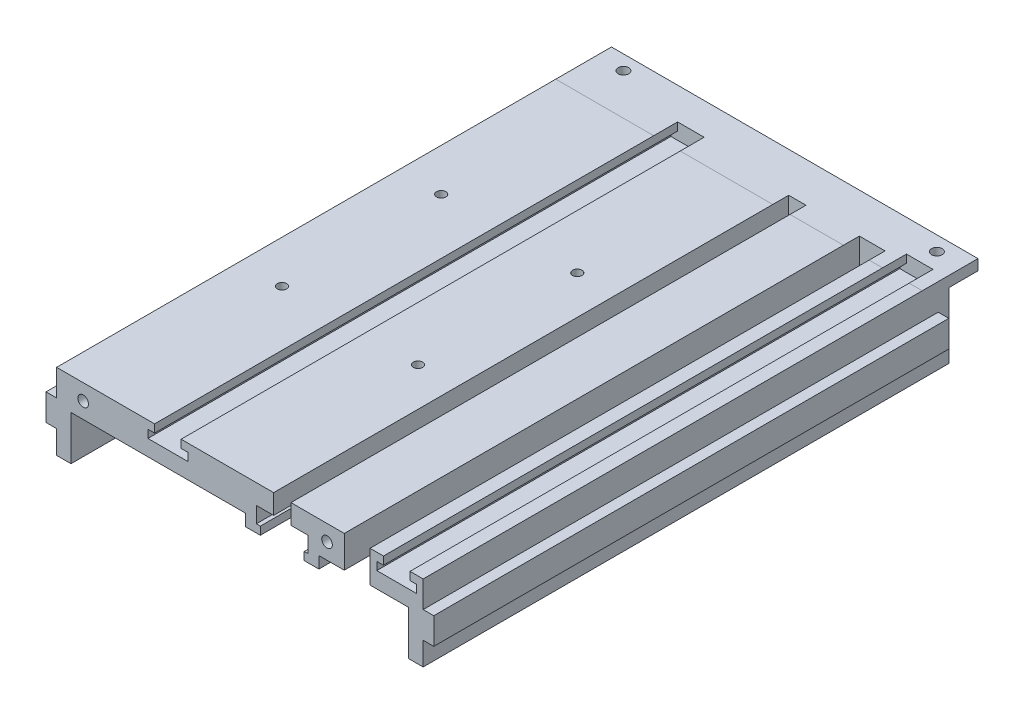
from build123d import *

# Parameters (mm, degrees)
CROQUIS1_W              = 170
CROQUIS1_H              = 50
SALIENTE_EXTRUIR1_DEPTH = 4
CROQUIS3_W              = 20
CROQUIS3_H              = 12.01
SALIENTE_EXTRUIR2_DEPTH = 194
CROQUIS22_W             = 170
CROQUIS22_H             = 21.26
CORTAR_EXTRUIR12_DEPTH  = 10
CROQUIS23_W             = 170
CROQUIS23_H             = 8.12284292
SALIENTE_EXTRUIR6_DEPTH = 11
CROQUIS25_W             = 6.514763964
CROQUIS25_H             = 194
CORTAR_EXTRUIR16_DEPTH  = 10
CROQUIS27_R             = 1.75
CORTAR_EXTRUIR17_DEPTH  = 30.74
CORTAR_EXTRUIR18_DEPTH  = 197
CROQUIS29_W             = 31.946298055
CROQUIS29_H             = 28.740140904
CORTAR_EXTRUIR19_DEPTH  = 197
CROQUIS30_R             = 2
CORTAR_EXTRUIR20_DEPTH  = 197
CROQUIS31_R             = 2
UNI_N_TECHO_DEPTH       = 10
CROQUIS33_R             = 2
CORTAR_EXTRUIR22_DEPTH  = 10
CROQUIS35_W             = 138.053701945
CROQUIS35_H             = 11
CORTAR_EXTRUIR24_DEPTH  = 4.12
SALIENTE_EXTRUIR7_DEPTH = 194


with BuildPart() as part:
    # Croquis1 → Saliente-Extruir1 (new body)
    with BuildSketch(Plane.XY):
        Rectangle(CROQUIS1_W, CROQUIS1_H)
    extrude(amount=SALIENTE_EXTRUIR1_DEPTH)

    # Croquis3 → Saliente-Extruir2 (add)
    with BuildSketch(Plane.XY.offset(4)):
        Polygon((-13.772145946, -12.69105844), (-9.772145946, -12.69105844), (-8.272145946, -12.69105844), (-8.272145946, -9.69105844), (-9.772145946, -9.69105844), (-9.772145946, -3.69105844), (9.772145946, -3.69105844), (9.772145946, -9.69105844), (8.272145946, -9.69105844), (8.272145946, -12.69105844), (9.772145946, -12.69105844), (13.772145946, -12.69105844), (13.772145946, -8.269859096), (23.357191672, -8.269859096), (23.357191672, 3.740140904), (-85, 3.740140904), (-85, -8.269859096), (-13.772145946, -8.269859096), align=None)
        with Locations((43.053701945, -2.264859096)):
            Rectangle(CROQUIS3_W, CROQUIS3_H)
    extrude(amount=SALIENTE_EXTRUIR2_DEPTH)

    # Croquis22 → Cortar-Extruir12 (cut)
    with BuildSketch(Plane(origin=(0, 0, 0), x_dir=(-1, 0, 0), z_dir=(0, 0, -1))):
        with Locations((0, 14.37)):
            Rectangle(CROQUIS22_W, CROQUIS22_H)
    extrude(amount=-CORTAR_EXTRUIR12_DEPTH, mode=Mode.SUBTRACT)

    # Croquis23 → Saliente-Extruir6 (add)
    with BuildSketch(Plane(origin=(0, 0, 0), x_dir=(-1, 0, 0), z_dir=(0, 0, -1))):
        with Locations((0, -0.32142146)):
            Rectangle(CROQUIS23_W, CROQUIS23_H)
    extrude(amount=SALIENTE_EXTRUIR6_DEPTH)

    # Croquis25 → Cortar-Extruir16 (cut)
    with BuildSketch(Plane.XZ.offset(3.69105844)):
        with Locations((0, 101)):
            Rectangle(CROQUIS25_W, CROQUIS25_H)
    extrude(amount=-CORTAR_EXTRUIR16_DEPTH, mode=Mode.SUBTRACT)

    # Croquis27 → Cortar-Extruir17 (cut)
    with BuildSketch(Plane.XZ.offset(8.269859096)):
        with Locations(Location((-69.012145946, 129.117553519, 0), (0, 0, 270))):
            Circle(CROQUIS27_R)
        with Locations(Location((-17.772145946, 129.117553519, 0), (0, 0, 270))):
            Circle(CROQUIS27_R)
        with Locations(Location((-69.012145946, 69.117553519, 0), (0, 0, 270))):
            Circle(CROQUIS27_R)
        with Locations(Location((-17.772145946, 69.117553519, 0), (0, 0, 270))):
            Circle(CROQUIS27_R)
    extrude(amount=-CORTAR_EXTRUIR17_DEPTH, mode=Mode.SUBTRACT)

    # Croquis28 → Cortar-Extruir18 (cut)
    with BuildSketch(Plane.XY.offset(198)):
        Polygon((50.605, 0.740140904), (50.605, -2.259859096), (35.605, -2.259859096), (35.605, 0.740140904), (38.105, 0.740140904), (38.105, 3.740140904), (48.105, 3.740140904), (48.105, 0.740140904), align=None)
        Polygon((-38.105, 3.740140904), (-48.105, 3.740140904), (-48.105, 0.740140904), (-50.605, 0.740140904), (-50.605, -2.259859096), (-35.605, -2.259859096), (-35.605, 0.740140904), (-38.105, 0.740140904), align=None)
    extrude(amount=-CORTAR_EXTRUIR18_DEPTH, mode=Mode.SUBTRACT)

    # Croquis29 → Cortar-Extruir19 (cut)
    with BuildSketch(Plane.XY.offset(4)):
        with Locations((69.026850973, -10.629929548)):
            Rectangle(CROQUIS29_W, CROQUIS29_H)
    extrude(amount=-CORTAR_EXTRUIR19_DEPTH, mode=Mode.SUBTRACT)

    # Croquis30 → Cortar-Extruir20 (cut)
    with BuildSketch(Plane.XY.offset(4)):
        with Locations((-72, -16.634929548)):
            Circle(CROQUIS30_R)
        with Locations((40.053701945, -16.634929548)):
            Circle(CROQUIS30_R)
    extrude(amount=-CORTAR_EXTRUIR20_DEPTH, mode=Mode.SUBTRACT)

    # Croquis31 → Unión techo (cut)
    with BuildSketch(Plane.XY.offset(198)):
        with Locations((-75, -2.264859096)):
            Circle(CROQUIS31_R)
        with Locations((16.857191672, -2.264859096)):
            Circle(CROQUIS31_R)
    extrude(amount=-UNI_N_TECHO_DEPTH, mode=Mode.SUBTRACT)

    # Croquis33 → Cortar-Extruir22 (cut)
    with BuildSketch(Plane.XZ.offset(4.38284292)):
        with Locations(Location((-75, -5.5, 0), (0, 0, 270))):
            Circle(CROQUIS33_R)
        with Locations(Location((43.053701945, -5.5, 0), (0, 0, 270))):
            Circle(CROQUIS33_R)
    extrude(amount=-CORTAR_EXTRUIR22_DEPTH, mode=Mode.SUBTRACT)

    # Croquis35 → Cortar-Extruir24 (cut)
    with BuildSketch(Plane.XZ.offset(4.38284292)):
        with Locations((-15.973149027, -5.5)):
            Rectangle(CROQUIS35_W, CROQUIS35_H)
    extrude(amount=-CORTAR_EXTRUIR24_DEPTH, mode=Mode.SUBTRACT)

    # Croquis36 → Saliente-Extruir7 (add)
    with BuildSketch(Plane.XY.offset(4)):
        Polygon((-85, -8.269859096), (-79.581388396, -8.269859096), (-79.581388396, -25), (-85, -25), (-85, -16.259859096), (-89, -16.259859096), (-89, -6.259859096), (-85, -6.259859096), align=None)
        Polygon((53.053701945, -8.269859096), (53.053701945, -6.259859096), (57.053701945, -6.259859096), (57.053701945, -16.259859096), (53.053701945, -16.259859096), (53.053701945, -25), (47.63509034, -25), (47.63509034, -8.269859096), align=None)
    extrude(amount=SALIENTE_EXTRUIR7_DEPTH)


solid = part.part
